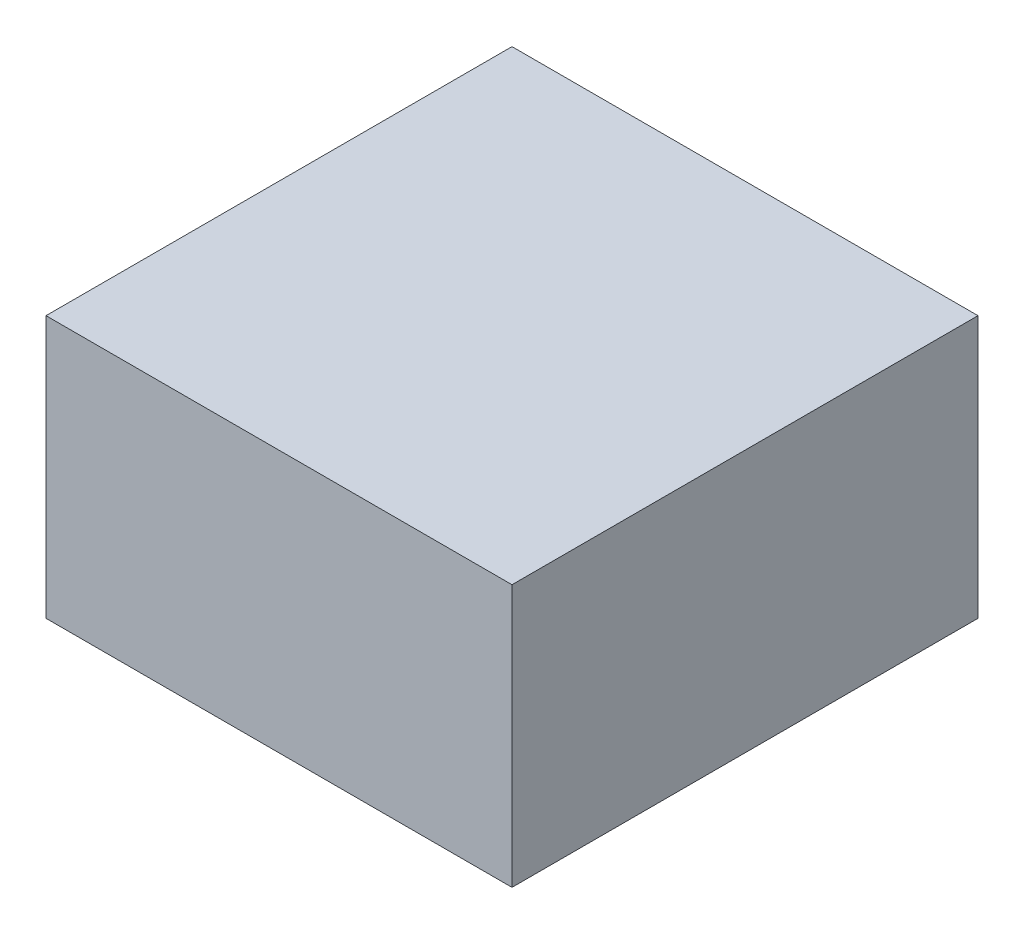
from build123d import *

# Parameters (mm, degrees)
SKETCH1_W           = 50.8
SKETCH1_H           = 50.8
BOSS_EXTRUDE1_DEPTH = 28.575


with BuildPart() as part:
    # Sketch1 → Boss-Extrude1 (new body)
    with BuildSketch(Plane(origin=(0, 0, 0), x_dir=(1, 0, 0), z_dir=(0, 1, 0))):
        Rectangle(SKETCH1_W, SKETCH1_H)
    extrude(amount=BOSS_EXTRUDE1_DEPTH)


solid = part.part
